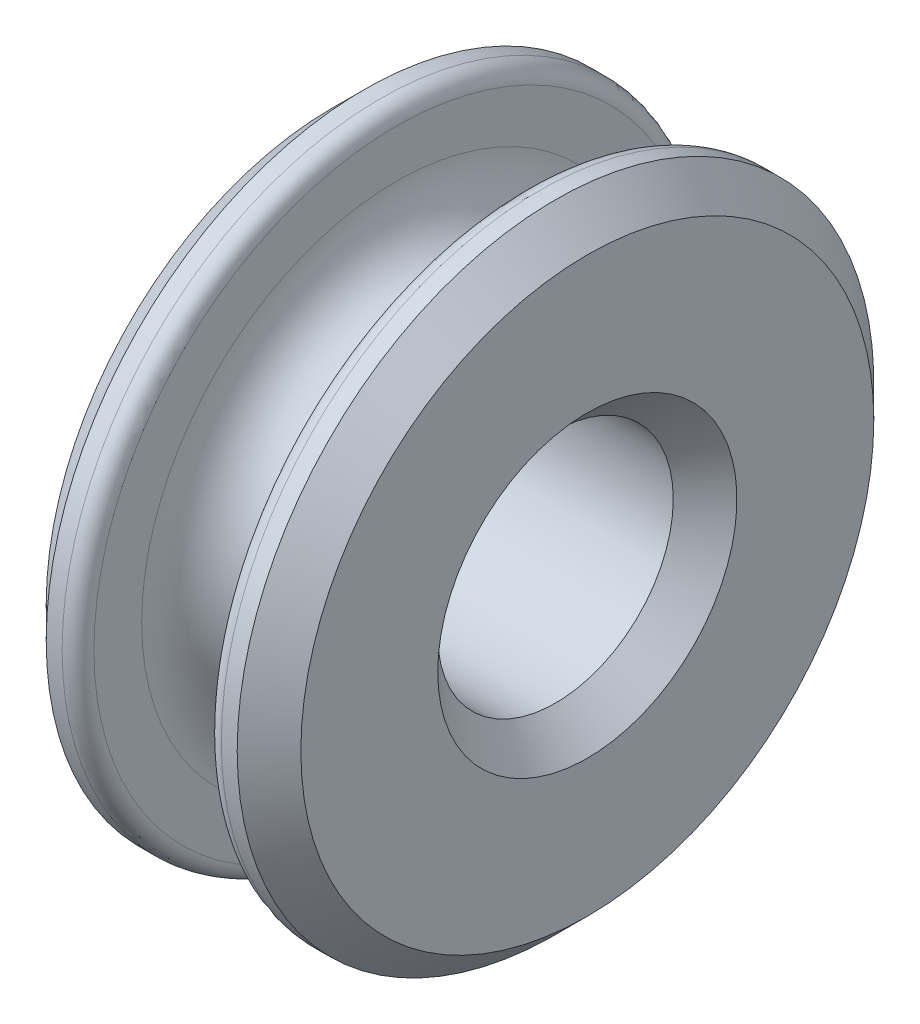
from build123d import *

# Parameters (mm, degrees)
FILLET1_R     = 0.25
CHAMFER1_SIZE = 0.5


with BuildPart() as part:
    # Sketch1 → Revolve1 (revolve)
    with BuildSketch(Plane.XY, mode=Mode.PRIVATE) as revolve1_sk:
        with BuildLine():
            Line((0, 5), (0, 1.85))
            Line((0, 1.85), (4, 1.85))
            Line((4, 1.85), (4, 5))
            Line((4, 5), (3, 5))
            Line((3, 5), (3, 4))
            ThreePointArc((3, 4), (2, 3), (1, 4))
            Line((1, 4), (1, 5))
            Line((1, 5), (0, 5))
        make_face()
    revolve(revolve1_sk.sketch.rotate(Axis((0, 0, 0), (1, 0, 0)), 90), axis=Axis((0, 0, 0), (1, 0, 0)))

    # Fillet1
    fillet1_edges = [part.edges().sort_by_distance(p)[0] for p in [
        (1, 0, -5),
        (3, 0, -5),
    ]]
    fillet(fillet1_edges, radius=FILLET1_R)

    # Chamfer1
    chamfer1_edges = [part.edges().sort_by_distance(p)[0] for p in [
        (0, 0, -5),
        (4, 0, -5),
        (4, 0, -1.85),
        (0, 0, -1.85),
    ]]
    chamfer(chamfer1_edges, length=CHAMFER1_SIZE)


solid = part.part
